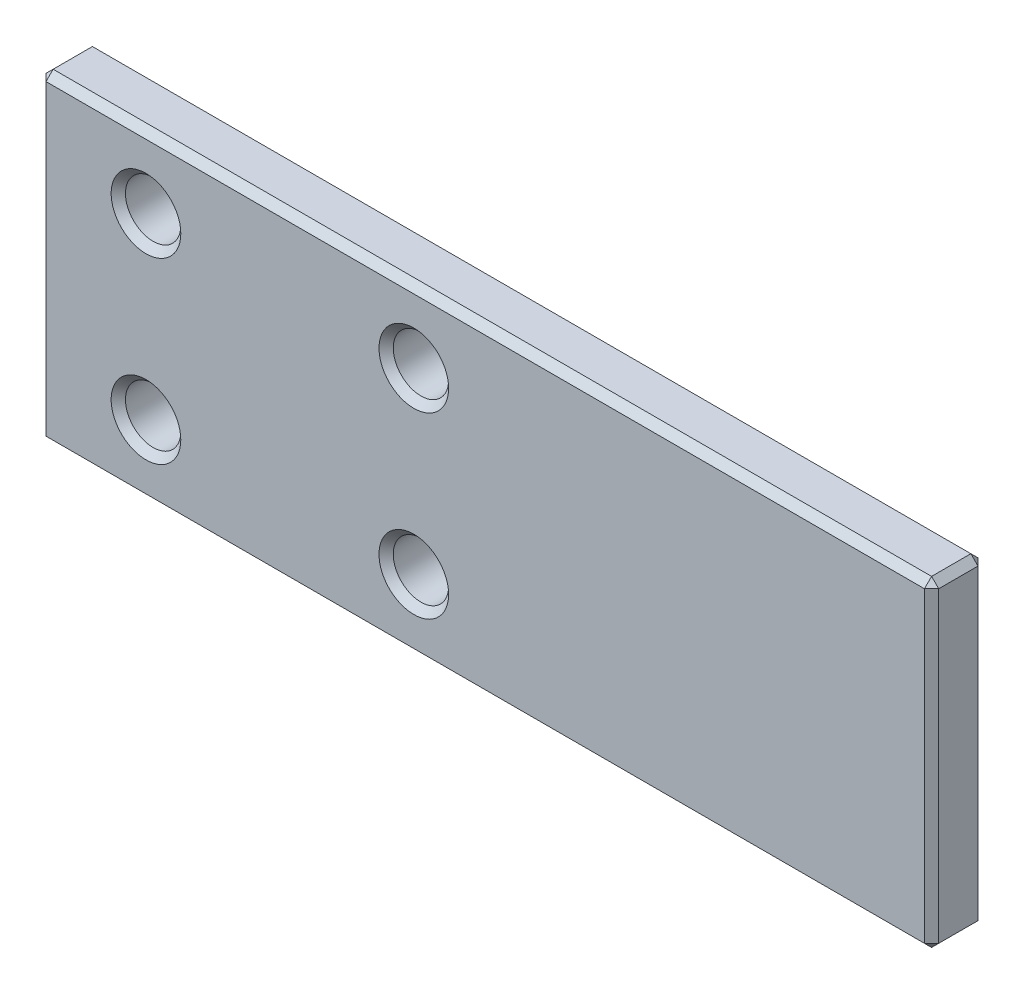
from build123d import *

# Parameters (mm, degrees)
SKIZZE1_W                       = 50
SKIZZE1_H                       = 18
AUFSATZ_LINEAR_AUSTRAGEN1_DEPTH = 3
SKIZZE2_R                       = 1.55
SCHNITT_LINEAR_AUSTRAGEN1_DEPTH = 37.043046724
FASE1_SIZE                      = 0.4


with BuildPart() as part:
    # Skizze1 → Aufsatz-Linear austragen1 (new body)
    with BuildSketch(Plane.XY):
        with Locations((9.62254438, -0.559322034)):
            Rectangle(SKIZZE1_W, SKIZZE1_H)
    extrude(amount=AUFSATZ_LINEAR_AUSTRAGEN1_DEPTH)

    # Skizze2 → Schnitt-Linear austragen1 (cut, through all)
    with BuildSketch(Plane(origin=(0, 0, 0), x_dir=(-1, 0, 0), z_dir=(0, 0, -1))):
        with Locations((9.37745562, 4.440677966)):
            Circle(SKIZZE2_R)
        with Locations((-5.62254438, 4.440677966)):
            Circle(SKIZZE2_R)
        with Locations((-5.62254438, -5.559322034)):
            Circle(SKIZZE2_R)
        with Locations((9.37745562, -5.559322034)):
            Circle(SKIZZE2_R)
    extrude(amount=-SCHNITT_LINEAR_AUSTRAGEN1_DEPTH, mode=Mode.SUBTRACT)

    # Fase1
    fase1_edges = [part.edges().sort_by_distance(p)[0] for p in [
        (34.62254438, -0.559322034, 3),
        (9.62254438, 8.440677966, 3),
        (-7.82745562, -5.559322034, 3),
        (-7.82745562, -5.559322034, 0),
        (7.17254438, -5.559322034, 3),
        (7.17254438, -5.559322034, 0),
        (7.17254438, 4.440677966, 3),
        (7.17254438, 4.440677966, 0),
        (-7.82745562, 4.440677966, 3),
        (-7.82745562, 4.440677966, 0),
        (-15.37745562, -0.559322034, 3),
        (9.62254438, 8.440677966, 0),
        (34.62254438, -0.559322034, 0),
        (9.62254438, -9.559322034, 0),
        (-15.37745562, -0.559322034, 0),
        (-15.37745562, 8.440677966, 1.5),
        (34.62254438, 8.440677966, 1.5),
        (34.62254438, -9.559322034, 1.5),
        (-15.37745562, -9.559322034, 1.5),
        (9.62254438, -9.559322034, 3),
    ]]
    chamfer(fase1_edges, length=FASE1_SIZE)


solid = part.part
